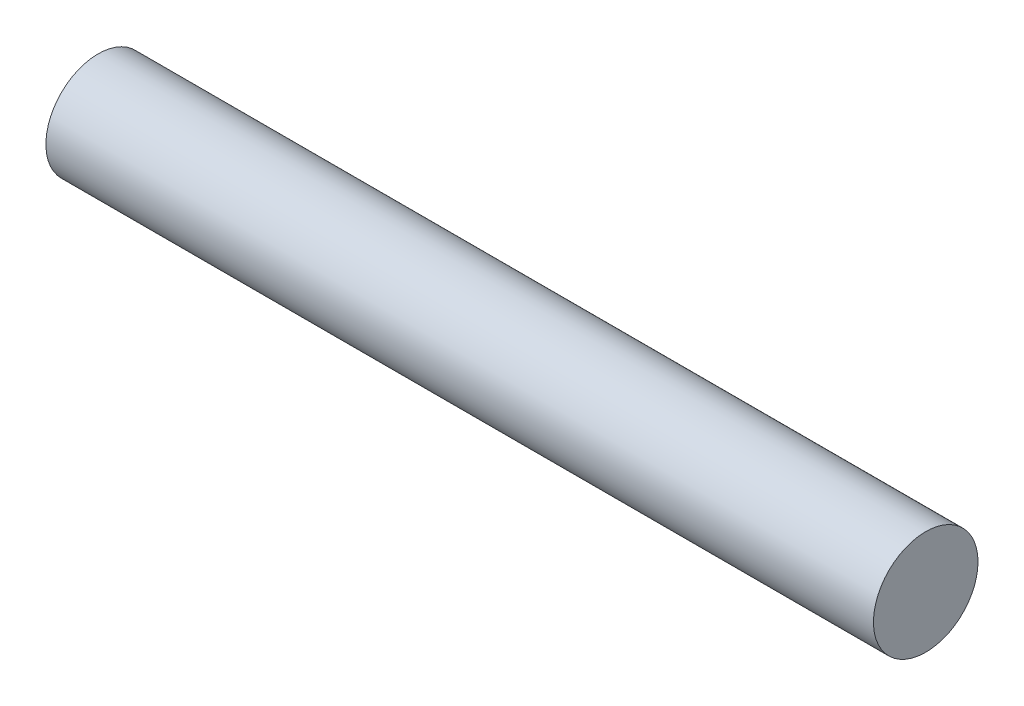
from build123d import *

# Parameters (mm, degrees)
SKETCH2_R           = 1.2
BOSS_EXTRUDE1_DEPTH = 19


with BuildPart() as part:
    # Sketch2 → Boss-Extrude1 (new body)
    with BuildSketch(Plane(origin=(0, 0, 0), x_dir=(0, 0, -1), z_dir=(1, 0, 0))):
        Circle(SKETCH2_R)
    extrude(amount=BOSS_EXTRUDE1_DEPTH)


solid = part.part
